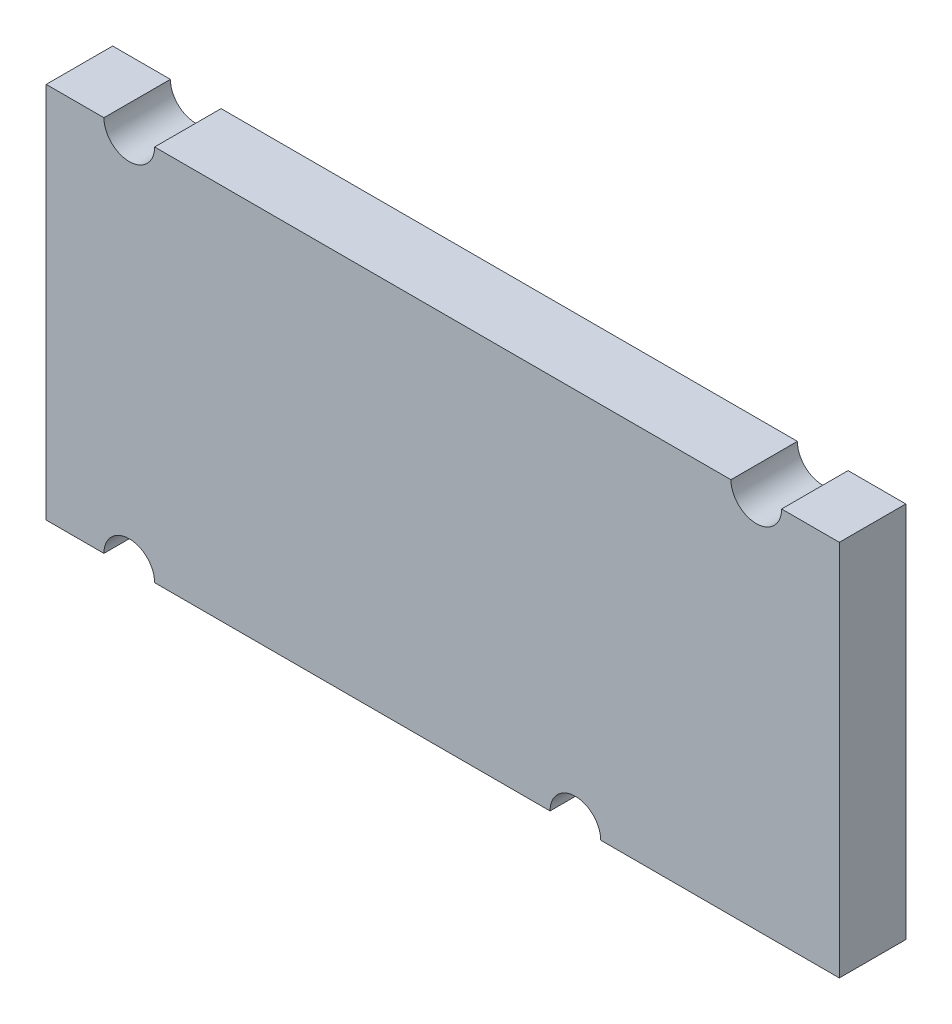
from build123d import *

# Parameters (mm, degrees)
EXTRUDE_1_DEPTH = 4


with BuildPart() as part:
    # 草图1 → 凸台-拉伸1 (new body)
    with BuildSketch(Plane.XY):
        with BuildLine():
            Line((27.621850365, 11.355), (24.146850365, 11.355))
            ThreePointArc((24.146850365, 11.355), (22.621850365, 9.83), (21.096850365, 11.355))
            Line((21.096850365, 11.355), (-13.589749635, 11.355))
            ThreePointArc((-13.589749635, 11.355), (-15.114749635, 9.83), (-16.639749635, 11.355))
            Line((-16.639749635, 11.355), (-20.114749635, 11.355))
            Line((-20.114749635, 11.355), (-20.114749635, -11.355))
            Line((-20.114749635, -11.355), (-16.639749635, -11.355))
            ThreePointArc((-16.639749635, -11.355), (-15.114749635, -9.83), (-13.589749635, -11.355))
            Line((-13.589749635, -11.355), (10.210250365, -11.355))
            ThreePointArc((10.210250365, -11.355), (11.735250365, -9.83), (13.260250365, -11.355))
            Line((13.260250365, -11.355), (27.621850365, -11.355))
            Line((27.621850365, -11.355), (27.621850365, 11.355))
        make_face()
    extrude(amount=EXTRUDE_1_DEPTH)


solid = part.part
